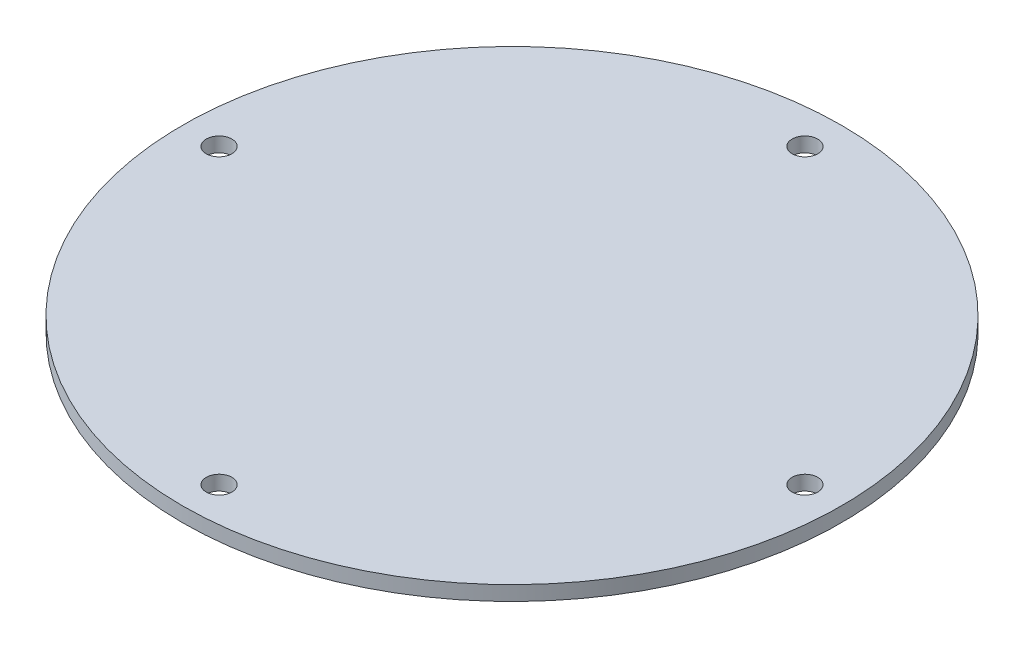
from build123d import *

# Parameters (mm, degrees)
SKETCH1_R           = 45
BOSS_EXTRUDE1_DEPTH = 2
SKETCH3_R           = 1.75
CUT_EXTRUDE1_DEPTH  = 64.671029519


with BuildPart() as part:
    # Sketch1 → Boss-Extrude1 (new body)
    with BuildSketch(Plane(origin=(0, 0, 0), x_dir=(1, 0, 0), z_dir=(0, 1, 0))):
        with Locations(Location((0, 0, 0), (0, 0, 270))):
            Circle(SKETCH1_R)
    extrude(amount=BOSS_EXTRUDE1_DEPTH)

    # Sketch3 → Cut-Extrude1 (cut, through all)
    with BuildSketch(Plane(origin=(0, 2, 0), x_dir=(1, 0, 0), z_dir=(0, 1, 0))):
        with Locations(Location((0, 40, 0), (0, 0, 270))):
            Circle(SKETCH3_R)
        with Locations(Location((40, 0, 0), (0, 0, 270))):
            Circle(SKETCH3_R)
        with Locations(Location((0, -40, 0), (0, 0, 270))):
            Circle(SKETCH3_R)
        with Locations(Location((-40, 0, 0), (0, 0, 270))):
            Circle(SKETCH3_R)
    extrude(amount=-CUT_EXTRUDE1_DEPTH, mode=Mode.SUBTRACT)


solid = part.part
